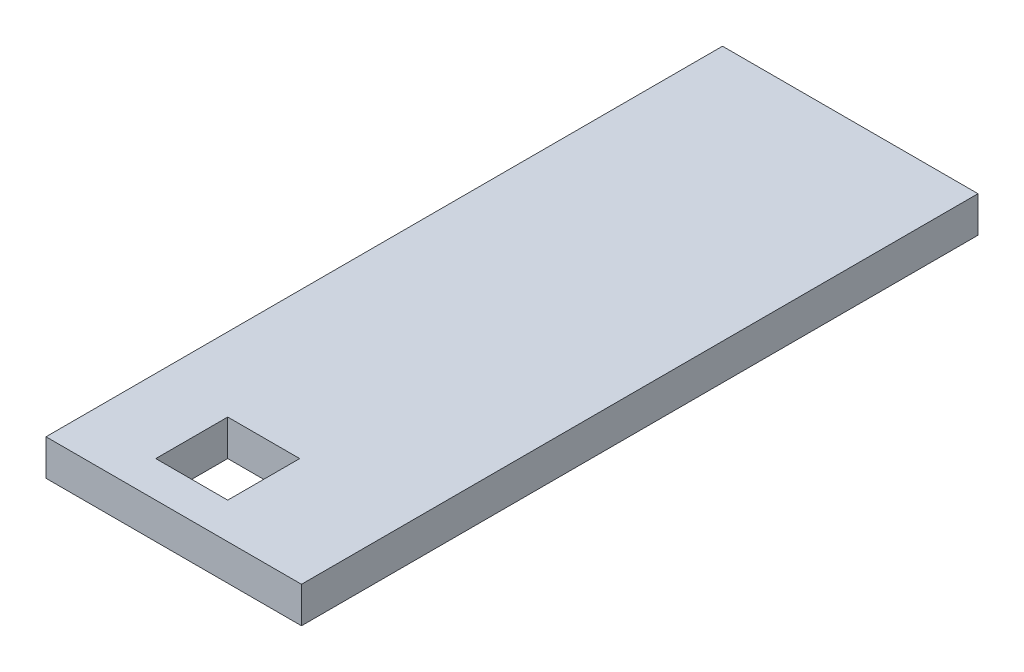
from build123d import *

# Parameters (mm, degrees)
SKETCH1_W           = 355
SKETCH1_H           = 50
BOSS_EXTRUDE1_DEPTH = 940
SKETCH2_W           = 100
SKETCH2_H           = 100
CUT_EXTRUDE1_DEPTH  = 1007.04423362


with BuildPart() as part:
    # Sketch1 → Boss-Extrude1 (new body)
    with BuildSketch(Plane.XY):
        with Locations((177.5, 25)):
            Rectangle(SKETCH1_W, SKETCH1_H)
    extrude(amount=BOSS_EXTRUDE1_DEPTH)

    # Sketch2 → Cut-Extrude1 (cut, through all)
    with BuildSketch(Plane(origin=(0, 50, 0), x_dir=(1, 0, 0), z_dir=(0, 1, 0))):
        with Locations((152.5, -840)):
            Rectangle(SKETCH2_W, SKETCH2_H)
    extrude(amount=-CUT_EXTRUDE1_DEPTH, mode=Mode.SUBTRACT)


solid = part.part
